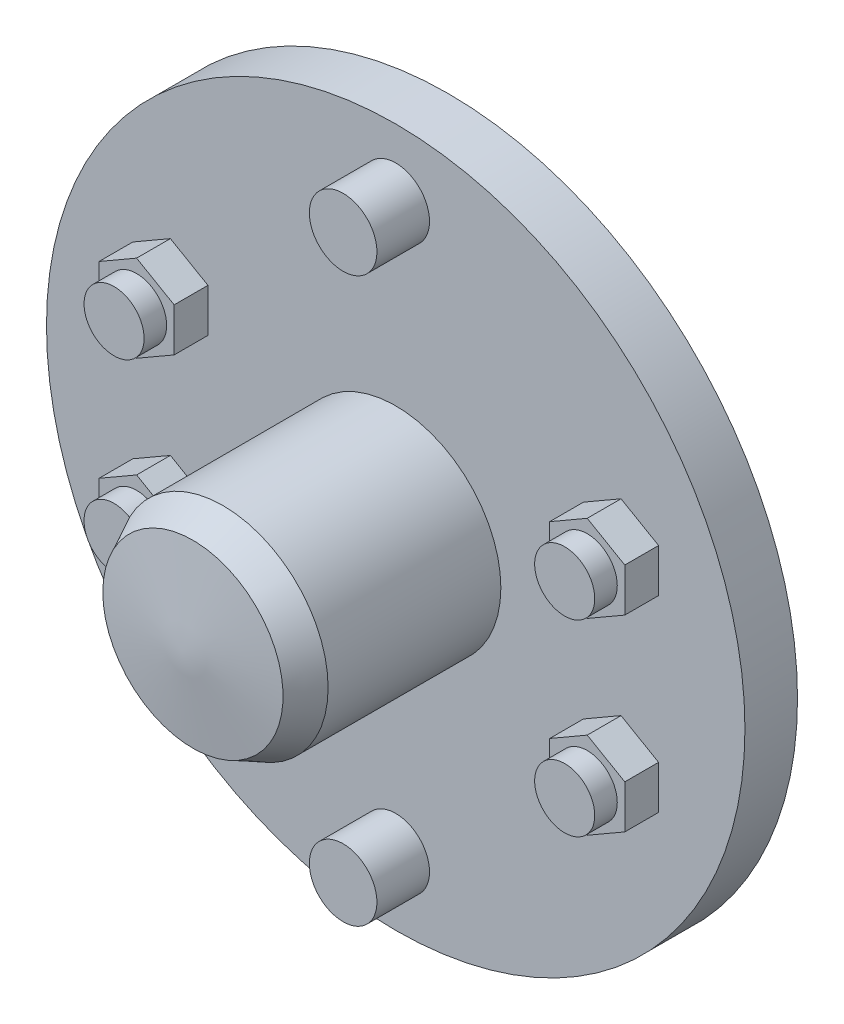
from build123d import *

# Parameters (mm, degrees)
EXTRUDE_START       = 309
EXTRUDE_SKETCH_1_R  = 93
EXTRUDE_1_DEPTH     = 14
EXTRUDE_START_2     = 323
EXTRUDE_SKETCH_2_R  = 28
EXTRUDE_2_DEPTH     = 46
EXTRUDE_3_DEPTH     = 9
EXTRUDE_START_3     = 332
EXTRUDE_SKETCH_4_R  = 8
EXTRUDE_4_DEPTH     = 6
EXTRUDE_5_DEPTH     = 9
EXTRUDE_SKETCH_6_R  = 8
EXTRUDE_6_DEPTH     = 6
EXTRUDE_7_DEPTH     = 9
EXTRUDE_SKETCH_8_R  = 8
EXTRUDE_8_DEPTH     = 6
EXTRUDE_9_DEPTH     = 9
EXTRUDE_SKETCH_10_R = 8
EXTRUDE_10_DEPTH    = 6
EXTRUDE_SKETCH_11_R = 9
EXTRUDE_11_DEPTH    = 14
EXTRUDE_SKETCH_12_R = 9
EXTRUDE_12_DEPTH    = 14


with BuildPart() as part:
    # Extrude sketch 1 → Extrude 1 (new body)
    with BuildSketch(Plane.XY.offset(EXTRUDE_START)):
        with Locations((240, 0)):
            Circle(EXTRUDE_SKETCH_1_R)
    extrude(amount=EXTRUDE_1_DEPTH)


with BuildPart() as body_2:
    # Extrude sketch 2 → Extrude 2 (new body)
    with BuildSketch(Plane.XY.offset(EXTRUDE_START_2)):
        with Locations((240, 0)):
            Circle(EXTRUDE_SKETCH_2_R)
    extrude(amount=EXTRUDE_2_DEPTH)


with BuildPart() as body_3:
    # Revolve profile 1 → Revolve 1 (revolve)
    with BuildSketch(Plane(origin=(0, 0, 0), x_dir=(1, 0, 0), z_dir=(0, 1, 0))):
        Polygon((240, -369), (268, -369), (264, -377), (240, -380), align=None)
    revolve(axis=Axis((240, 0, 364), (0, 0, 1)))


with BuildPart() as body_4:
    # Extrude sketch 3 → Extrude 3 (new body)
    with BuildSketch(Plane.XY.offset(EXTRUDE_START_2)):
        Polygon((310, 30.773502692), (300, 36.547005384), (290, 30.773502692), (290, 19.226497308), (300, 13.452994616), (310, 19.226497308), align=None)
    extrude(amount=EXTRUDE_3_DEPTH)


with BuildPart() as body_5:
    # Extrude sketch 4 → Extrude 4 (new body)
    with BuildSketch(Plane.XY.offset(EXTRUDE_START_3)):
        with Locations((300, 25)):
            Circle(EXTRUDE_SKETCH_4_R)
    extrude(amount=EXTRUDE_4_DEPTH)


with BuildPart() as body_6:
    # Extrude sketch 5 → Extrude 5 (new body)
    with BuildSketch(Plane.XY.offset(EXTRUDE_START_2)):
        Polygon((310, -19.226497308), (300, -13.452994616), (290, -19.226497308), (290, -30.773502692), (300, -36.547005384), (310, -30.773502692), align=None)
    extrude(amount=EXTRUDE_5_DEPTH)


with BuildPart() as body_7:
    # Extrude sketch 6 → Extrude 6 (new body)
    with BuildSketch(Plane.XY.offset(EXTRUDE_START_3)):
        with Locations((300, -25)):
            Circle(EXTRUDE_SKETCH_6_R)
    extrude(amount=EXTRUDE_6_DEPTH)


with BuildPart() as body_8:
    # Extrude sketch 7 → Extrude 7 (new body)
    with BuildSketch(Plane.XY.offset(EXTRUDE_START_2)):
        Polygon((190, 30.773502692), (180, 36.547005384), (170, 30.773502692), (170, 19.226497308), (180, 13.452994616), (190, 19.226497308), align=None)
    extrude(amount=EXTRUDE_7_DEPTH)


with BuildPart() as body_9:
    # Extrude sketch 8 → Extrude 8 (new body)
    with BuildSketch(Plane.XY.offset(EXTRUDE_START_3)):
        with Locations((180, 25)):
            Circle(EXTRUDE_SKETCH_8_R)
    extrude(amount=EXTRUDE_8_DEPTH)


with BuildPart() as body_10:
    # Extrude sketch 9 → Extrude 9 (new body)
    with BuildSketch(Plane.XY.offset(EXTRUDE_START_2)):
        Polygon((190, -19.226497308), (180, -13.452994616), (170, -19.226497308), (170, -30.773502692), (180, -36.547005384), (190, -30.773502692), align=None)
    extrude(amount=EXTRUDE_9_DEPTH)


with BuildPart() as body_11:
    # Extrude sketch 10 → Extrude 10 (new body)
    with BuildSketch(Plane.XY.offset(EXTRUDE_START_3)):
        with Locations((180, -25)):
            Circle(EXTRUDE_SKETCH_10_R)
    extrude(amount=EXTRUDE_10_DEPTH)


with BuildPart() as body_12:
    # Extrude sketch 11 → Extrude 11 (new body)
    with BuildSketch(Plane.XY.offset(EXTRUDE_START_2)):
        with Locations((240, 75)):
            Circle(EXTRUDE_SKETCH_11_R)
    extrude(amount=EXTRUDE_11_DEPTH)


with BuildPart() as body_13:
    # Extrude sketch 12 → Extrude 12 (new body)
    with BuildSketch(Plane.XY.offset(EXTRUDE_START_2)):
        with Locations((240, -75)):
            Circle(EXTRUDE_SKETCH_12_R)
    extrude(amount=EXTRUDE_12_DEPTH)


with BuildPart() as body_10_1:
    add(body_10.part)

    # Combine (weld / assembly of features): union body 4, body 9, body 5, body 11, body 2, body 12, body 8, body 6, body 3, body 13, body 7, part
    add(body_4.part)
    add(body_9.part)
    add(body_5.part)
    add(body_11.part)
    add(body_2.part)
    add(body_12.part)
    add(body_8.part)
    add(body_6.part)
    add(body_3.part)
    add(body_13.part)
    add(body_7.part)
    add(part.part)


solid = body_10_1.part
